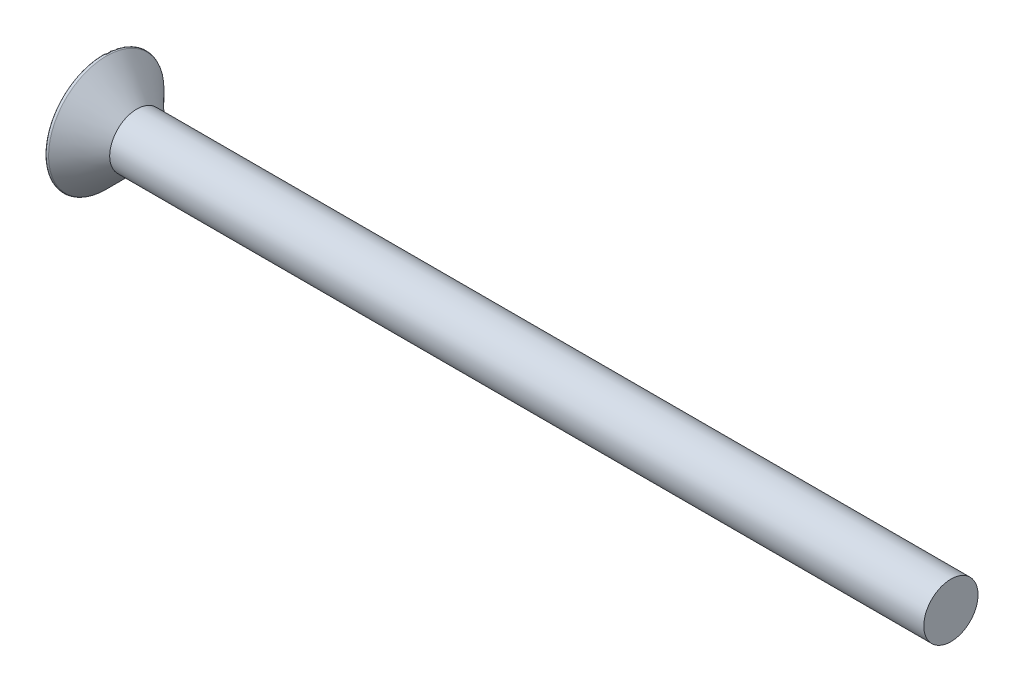
from build123d import *

# Parameters (mm, degrees)
CONG_1_R = 0.1


with BuildPart() as part:
    # Esquisse1 → Révolution1 (revolve)
    with BuildSketch(Plane.XY, mode=Mode.PRIVATE) as r_volution1_sk:
        Polygon((0, 0), (0, 3.36), (1.86, 1.5), (46.86, 1.5), (46.86, 0), align=None)
    revolve(r_volution1_sk.sketch.rotate(Axis((0, 0, 0), (1, 0, 0)), 90), axis=Axis((0, 0, 0), (1, 0, 0)))

    # Congé1
    cong_1_edges = [part.edges().sort_by_distance(p)[0] for p in [
        (0, 0, -3.36),
    ]]
    fillet(cong_1_edges, radius=CONG_1_R)


solid = part.part
